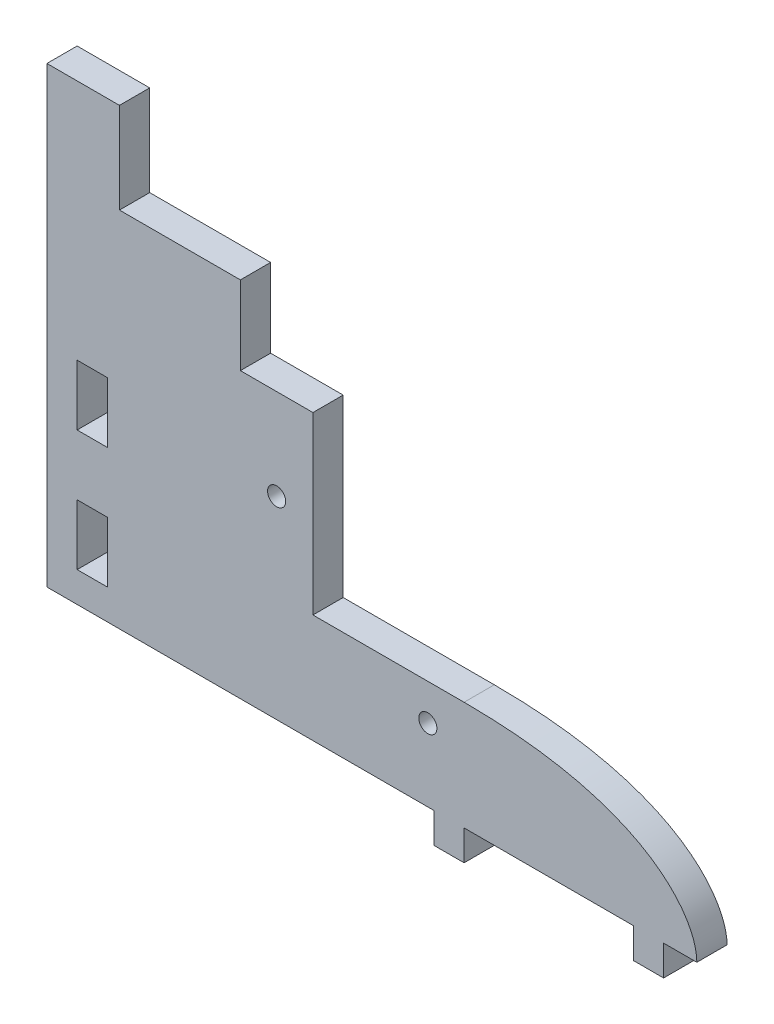
from build123d import *

# Parameters (mm, degrees)
ESQUISSE1_R        = 1.5
BOSS_EXTRU_1_DEPTH = 5
ESQUISSE2_W        = 5
ESQUISSE2_H        = 10
BOSS_EXTRU_2_DEPTH = 5


with BuildPart() as part:
    # Esquisse1 → Boss.-Extru.1 (new body)
    with BuildSketch(Plane.XY):
        Polygon((0, 0), (32, 0), (32, -5), (37, -5), (37, 0), (37, 18), (12, 18), (12, 47), (0, 47), align=None)
        with Locations((6, 32)):
            Circle(ESQUISSE1_R, mode=Mode.SUBTRACT)
        with Locations((31, 12)):
            Circle(ESQUISSE1_R, mode=Mode.SUBTRACT)
    extrude(amount=BOSS_EXTRU_1_DEPTH)

    # Esquisse2 → Boss.-Extru.2 (add)
    # profile 1 of 2: a face of its own
    with BuildSketch(Plane(origin=(0, 0, 0), x_dir=(-1, 0, 0), z_dir=(0, 0, -1))):
        with BuildLine():
            Line((-65, 0), (-37, 0))
            Line((-37, 0), (-37, 18))
            add(Edge.make_bspline(
                [(-75.5, 0), (-75.5, 5.982232529), (-67.685409636, 18), (-37, 18)],
                knots=[0, 0, 0, 0, 1, 1, 1, 1], degree=3))
            Line((-75.5, 0), (-70, 0))
            Line((-70, 0), (-70, -5))
            Line((-70, -5), (-65, -5))
            Line((-65, -5), (-65, 0))
        make_face()
    # profile 2 of 2: a face of its own
    with BuildSketch(Plane(origin=(0, 0, 0), x_dir=(-1, 0, 0), z_dir=(0, 0, -1))):
        Polygon((0, 60), (0, 0), (32, 0), (32, 75), (20, 75), (20, 60), align=None)
        with Locations((24.5, 10)):
            Rectangle(ESQUISSE2_W, ESQUISSE2_H, mode=Mode.SUBTRACT)
        with Locations((24.5, 30)):
            Rectangle(ESQUISSE2_W, ESQUISSE2_H, mode=Mode.SUBTRACT)
    extrude(amount=-BOSS_EXTRU_2_DEPTH)


solid = part.part
